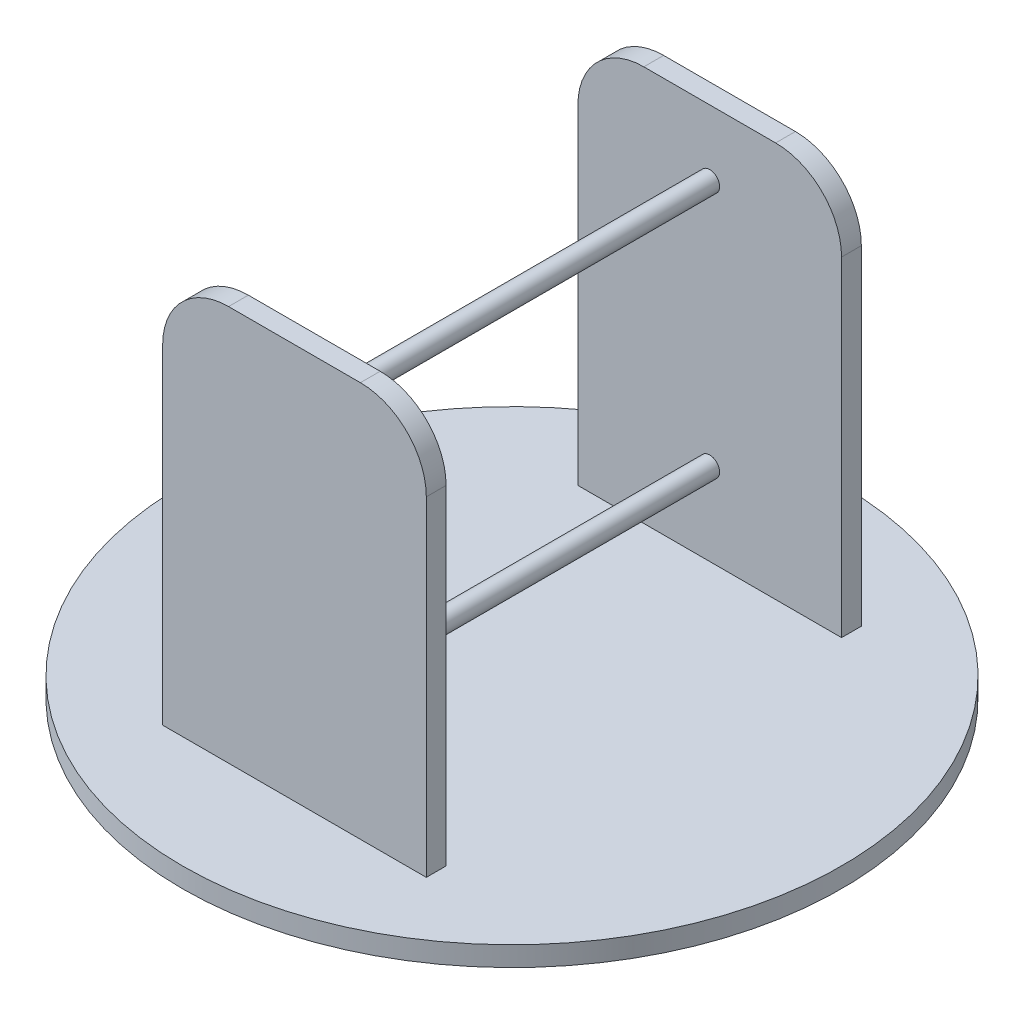
from build123d import *

# Parameters (mm, degrees)
SKETCH1_R           = 50
BOSS_EXTRUDE1_DEPTH = 3
SKETCH3_W           = 40
SKETCH3_H           = 3
BOSS_EXTRUDE3_DEPTH = 60
SKETCH4_R           = 1.5
BOSS_EXTRUDE4_DEPTH = 63
FILLET1_R           = 10


with BuildPart() as part:
    # Sketch1 → Boss-Extrude1 (new body)
    with BuildSketch(Plane(origin=(0, 0, 0), x_dir=(1, 0, 0), z_dir=(0, 1, 0))):
        with Locations(Location((0, 0, 0), (0, 0, 270))):
            Circle(SKETCH1_R)
    extrude(amount=BOSS_EXTRUDE1_DEPTH)

    # Sketch3 → Boss-Extrude3 (add)
    with BuildSketch(Plane(origin=(0, 3, 0), x_dir=(1, 0, 0), z_dir=(0, 1, 0))):
        with Locations((0, -31.5)):
            Rectangle(SKETCH3_W, SKETCH3_H)
        with Locations((0, 31.5)):
            Rectangle(SKETCH3_W, SKETCH3_H)
    extrude(amount=BOSS_EXTRUDE3_DEPTH)

    # Sketch4 → Boss-Extrude4 (add)
    with BuildSketch(Plane.XY.offset(33)):
        with Locations((0, 53)):
            Circle(SKETCH4_R)
        with Locations((0, 15.5)):
            Circle(SKETCH4_R)
    extrude(amount=-BOSS_EXTRUDE4_DEPTH)

    # Fillet1
    fillet1_edges = [part.edges().sort_by_distance(p)[0] for p in [
        (-20, 63, -31.5),
        (20, 63, -31.5),
        (-20, 63, 31.5),
        (20, 63, 31.5),
    ]]
    fillet(fillet1_edges, radius=FILLET1_R)


solid = part.part
